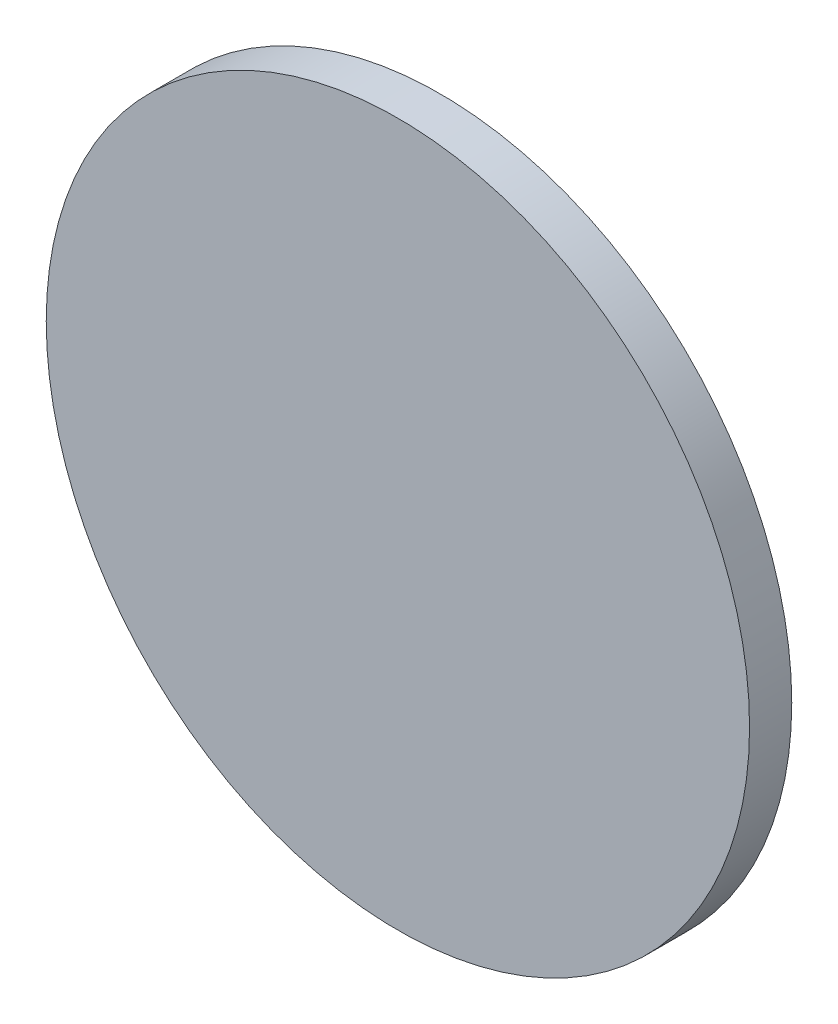
from build123d import *

# Parameters (mm, degrees)
SKETCH1_R           = 125
BOSS_EXTRUDE1_DEPTH = 15


with BuildPart() as part:
    # Sketch1 → Boss-Extrude1 (new body)
    with BuildSketch(Plane.XY):
        Circle(SKETCH1_R)
    extrude(amount=BOSS_EXTRUDE1_DEPTH)


solid = part.part
